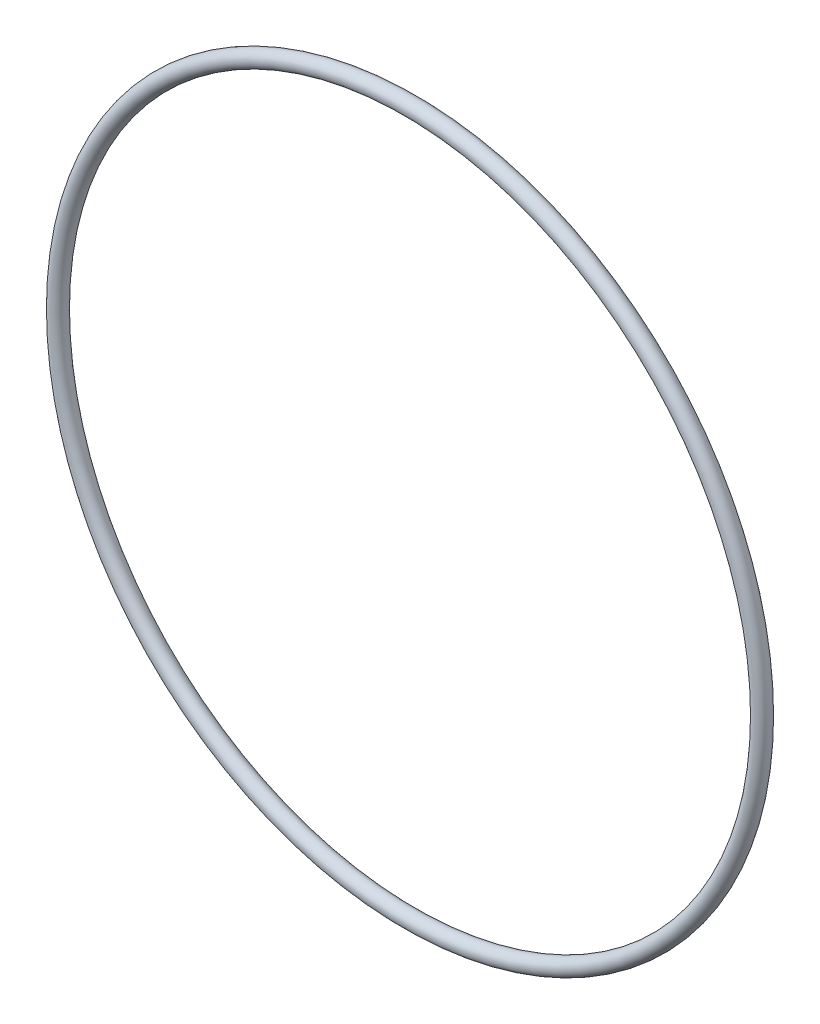
from build123d import *

# Parameters (mm, degrees)
SKETCH1_R = 1.7653


with BuildPart() as part:
    # Sketch1 → Revolve1 (revolve)
    with BuildSketch(Plane(origin=(0, 0, 0), x_dir=(0, -1, 0), z_dir=(1, 0, 0)), mode=Mode.PRIVATE) as revolve1_sk:
        with Locations((76.1746, 0)):
            Circle(SKETCH1_R)
    revolve(revolve1_sk.sketch.rotate(Axis((0, 0, 1.7653), (0, 0, -1)), 270), axis=Axis((0, 0, 1.7653), (0, 0, -1)))


solid = part.part
